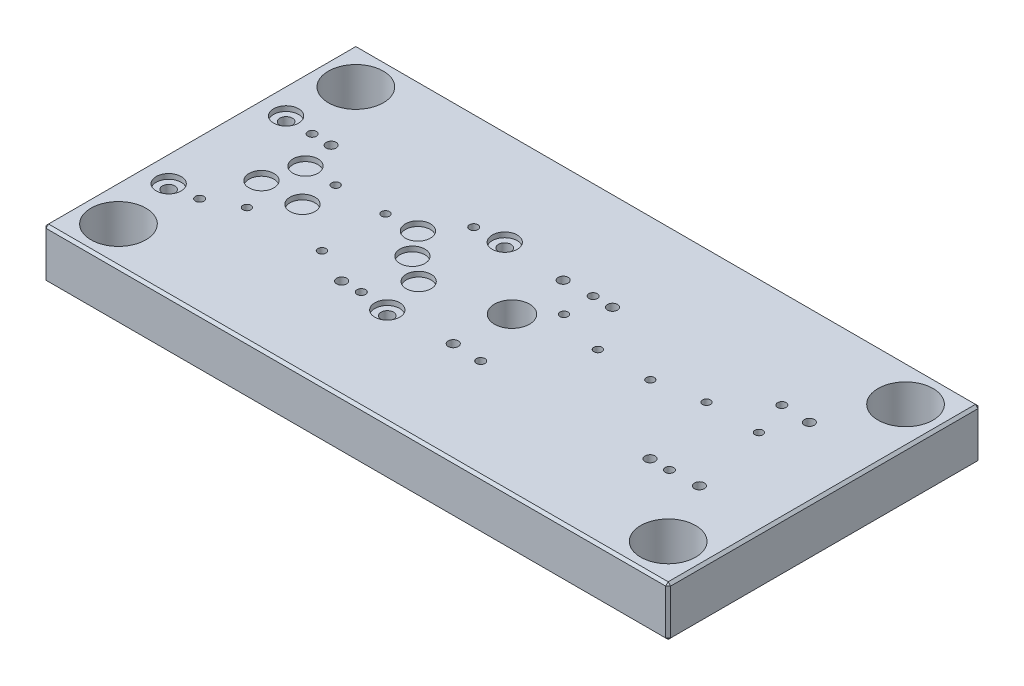
from build123d import *

# Parameters (mm, degrees)
SKETCH2_W                                           = 500
SKETCH2_H                                           = 125
BOSS_EXTRUDE1_DEPTH                                 = 40
SKETCH3_W                                           = 500
SKETCH3_H                                           = 40
BOSS_EXTRUDE2_DEPTH                                 = 125
SKETCH6_R                                           = 22
CUT_EXTRUDE1_DEPTH                                  = 316.04959927
M30X2_0_TAPPED_HOLE1_D                              = 28
CHAMFER1_SIZE                                       = 2
M8_TAPPED_HOLE1_D                                   = 6.8
F_8_0MM_DOWEL_HOLE1_D                               = 8
CBORE_FOR_M6_HEX_SOCKET_HEAD_CAP_SCREW1_D           = 6.4
CBORE_FOR_M6_HEX_SOCKET_HEAD_CAP_SCREW1_CBORE_D     = 11
CBORE_FOR_M6_HEX_SOCKET_HEAD_CAP_SCREW1_CBORE_DEPTH = 6.4
CBORE_FOR_M6_HEX_SOCKET_HEAD_CAP_SCREW2_D           = 6.4
CBORE_FOR_M6_HEX_SOCKET_HEAD_CAP_SCREW2_CBORE_D     = 11
CBORE_FOR_M6_HEX_SOCKET_HEAD_CAP_SCREW2_CBORE_DEPTH = 6.4
SKETCH25_R                                          = 10
CUT_EXTRUDE2_DEPTH                                  = 4
F_10_0_10_DIAMETER_HOLE1_D                          = 10
SKETCH35_R                                          = 8.5
CUT_EXTRUDE3_DEPTH                                  = 24
F_8_0_8_DIAMETER_HOLE2_D                            = 8
SKETCH43_R                                          = 7
CUT_EXTRUDE4_DEPTH                                  = 32


with BuildPart() as part:
    # Sketch2 → Boss-Extrude1 (new body)
    with BuildSketch(Plane(origin=(0, 0, 0), x_dir=(1, 0, 0), z_dir=(0, 1, 0))):
        Rectangle(SKETCH2_W, SKETCH2_H)
    extrude(amount=BOSS_EXTRUDE1_DEPTH)

    # Sketch3 → Boss-Extrude2 (add)
    with BuildSketch(Plane(origin=(0, 0, -62.5), x_dir=(-1, 0, 0), z_dir=(0, 0, -1))):
        with Locations((0, 20)):
            Rectangle(SKETCH3_W, SKETCH3_H)
    extrude(amount=BOSS_EXTRUDE2_DEPTH)

    # Sketch6 → Cut-Extrude1 (cut, through all)
    with BuildSketch(Plane(origin=(0, 0, 0), x_dir=(-1, 0, 0), z_dir=(0, -1, 0))):
        with Locations(Location((-220, 157.5, 0), (0, 0, 90))):
            Circle(SKETCH6_R)
        with Locations(Location((-220, -32.5, 0), (0, 0, 90))):
            Circle(SKETCH6_R)
    cut_extrude1 = extrude(amount=-CUT_EXTRUDE1_DEPTH, mode=Mode.SUBTRACT)

    # Mirror1: Cut-Extrude1 across plane
    add(cut_extrude1.mirror(Plane(origin=(0, 0, 0), x_dir=(0, 0, 1), z_dir=(1, 0, 0))), mode=Mode.SUBTRACT)

    # M30x2.0 Tapped Hole1 (through all)
    with Locations(Plane(origin=(0, 40, 0), x_dir=(1, 0, 0), z_dir=(0, 1, 0))):
        with Locations((0, 62.5)):
            Hole(M30X2_0_TAPPED_HOLE1_D / 2)

    # Chamfer1
    chamfer1_edges = [part.edges().sort_by_distance(p)[0] for p in [
        (-250, 40, -62.5),
        (0, 40, -187.5),
        (0, 40, 62.5),
        (250, 20, -187.5),
        (0, 0, -187.5),
        (-250, 20, -187.5),
        (250, 40, -62.5),
        (0, 0, 62.5),
        (-250, 0, -62.5),
        (250, 0, -62.5),
        (250, 20, 62.5),
        (-250, 20, 62.5),
    ]]
    chamfer(chamfer1_edges, length=CHAMFER1_SIZE)

    # M8 Tapped Hole1 (through all)
    with Locations(Plane(origin=(0, 0, 0), x_dir=(-1, 0, 0), z_dir=(0, -1, 0))):
        with Locations((-171, 17.5), (-19.969, 17.5), (-19.969, 107.5), (-171, 107.5), (75.632503002, 107.5), (205, 107.5), (205, 17.5), (75.632503002, 17.5)):
            Hole(M8_TAPPED_HOLE1_D / 2)

    # Ø8.0mm Dowel Hole1 (through all)
    with Locations(Plane(origin=(0, 0, 0), x_dir=(-1, 0, 0), z_dir=(0, -1, 0))):
        with Locations((-155.5, 17.5), (-35.469, 107.5), (91.132503002, 17.258975019), (189.5, 107.228378806)):
            Hole(F_8_0MM_DOWEL_HOLE1_D / 2)

    # CBORE for M6 Hex Socket Head Cap Screw1 (through all)
    with Locations(Plane(origin=(0, 0, 0), x_dir=(-1, 0, 0), z_dir=(0, -1, 0))):
        with Locations((-180.875, 79.28), (-100.875, 72.352366083), (-58.875, 72.352366083), (-20.875, 83.19101), (-138.875, 79.28)):
            CounterBoreHole(CBORE_FOR_M6_HEX_SOCKET_HEAD_CAP_SCREW1_D / 2, CBORE_FOR_M6_HEX_SOCKET_HEAD_CAP_SCREW1_CBORE_D / 2, CBORE_FOR_M6_HEX_SOCKET_HEAD_CAP_SCREW1_CBORE_DEPTH)

    # CBORE for M6 Hex Socket Head Cap Screw2 (through all)
    with Locations(Plane(origin=(0, 0, 0), x_dir=(-1, 0, 0), z_dir=(0, -1, 0))):
        with Locations((160, 81.36), (120.125, 81.36), (120, 30.34), (180, 30.34)):
            CounterBoreHole(CBORE_FOR_M6_HEX_SOCKET_HEAD_CAP_SCREW2_D / 2, CBORE_FOR_M6_HEX_SOCKET_HEAD_CAP_SCREW2_CBORE_D / 2, CBORE_FOR_M6_HEX_SOCKET_HEAD_CAP_SCREW2_CBORE_DEPTH)

    # Sketch25 → Cut-Extrude2 (cut)
    with BuildSketch(Plane(origin=(0, 40, 0), x_dir=(1, 0, 0), z_dir=(0, 1, 0))):
        with Locations(Location((-227.816251501, 15.5, 0), (0, 0, 270))):
            Circle(SKETCH25_R)
        with Locations(Location((-52.816251501, 15.5, 0), (0, 0, 270))):
            Circle(SKETCH25_R)
        with Locations(Location((-52.816251501, 109.5, 0), (0, 0, 270))):
            Circle(SKETCH25_R)
        with Locations(Location((-227.816251501, 109.5, 0), (0, 0, 270))):
            Circle(SKETCH25_R)
        with Locations(Location((-185.316251501, 82.5, 0), (0, 0, 270))):
            Circle(SKETCH25_R)
        with Locations(Location((-192.816251501, 54.78, 0), (0, 0, 270))):
            Circle(SKETCH25_R)
        with Locations(Location((-160, 54.78, 0), (0, 0, 270))):
            Circle(SKETCH25_R)
        with Locations(Location((-95.316251501, 82.5, 0), (0, 0, 270))):
            Circle(SKETCH25_R)
        with Locations(Location((-80, 62.78, 0), (0, 0, 270))):
            Circle(SKETCH25_R)
        with Locations(Location((-60, 47.78, 0), (0, 0, 270))):
            Circle(SKETCH25_R)
    extrude(amount=-CUT_EXTRUDE2_DEPTH, mode=Mode.SUBTRACT)

    # Ø10.0 (10) Diameter Hole1 (through all)
    with Locations(Plane(origin=(0, 40, 0), x_dir=(1, 0, 0), z_dir=(0, 1, 0))):
        with Locations((-52.816251501, 15.5), (-227.816251501, 109.5), (-227.816251501, 15.5), (-52.816251501, 109.5)):
            Hole(F_10_0_10_DIAMETER_HOLE1_D / 2)

    # Sketch35 → Cut-Extrude3 (cut)
    with BuildSketch(Plane.XZ):
        with Locations(Location((-52.816251501, -109.5, 0), (0, 0, 270))):
            Circle(SKETCH35_R)
        with Locations(Location((-227.816251501, -15.5, 0), (0, 0, 270))):
            Circle(SKETCH35_R)
        with Locations(Location((-227.816251501, -109.5, 0), (0, 0, 270))):
            Circle(SKETCH35_R)
        with Locations(Location((-52.816251501, -15.5, 0), (0, 0, 270))):
            Circle(SKETCH35_R)
    extrude(amount=-CUT_EXTRUDE3_DEPTH, mode=Mode.SUBTRACT)

    # Ø8.0 (8) Diameter Hole2 (through all)
    with Locations(Plane(origin=(0, 40, 0), x_dir=(1, 0, 0), z_dir=(0, 1, 0))):
        with Locations((-3.031, 106.5), (-3.031, 18.5), (194, 106.5), (194, 18.5)):
            Hole(F_8_0_8_DIAMETER_HOLE2_D / 2)

    # Sketch43 → Cut-Extrude4 (cut)
    with BuildSketch(Plane.XZ):
        with Locations(Location((194, -106.5, 0), (0, 0, 270))):
            Circle(SKETCH43_R)
        with Locations(Location((194, -18.5, 0), (0, 0, 270))):
            Circle(SKETCH43_R)
        with Locations(Location((-3.031, -18.5, 0), (0, 0, 270))):
            Circle(SKETCH43_R)
        with Locations(Location((-3.031, -106.5, 0), (0, 0, 270))):
            Circle(SKETCH43_R)
    extrude(amount=-CUT_EXTRUDE4_DEPTH, mode=Mode.SUBTRACT)


solid = part.part
